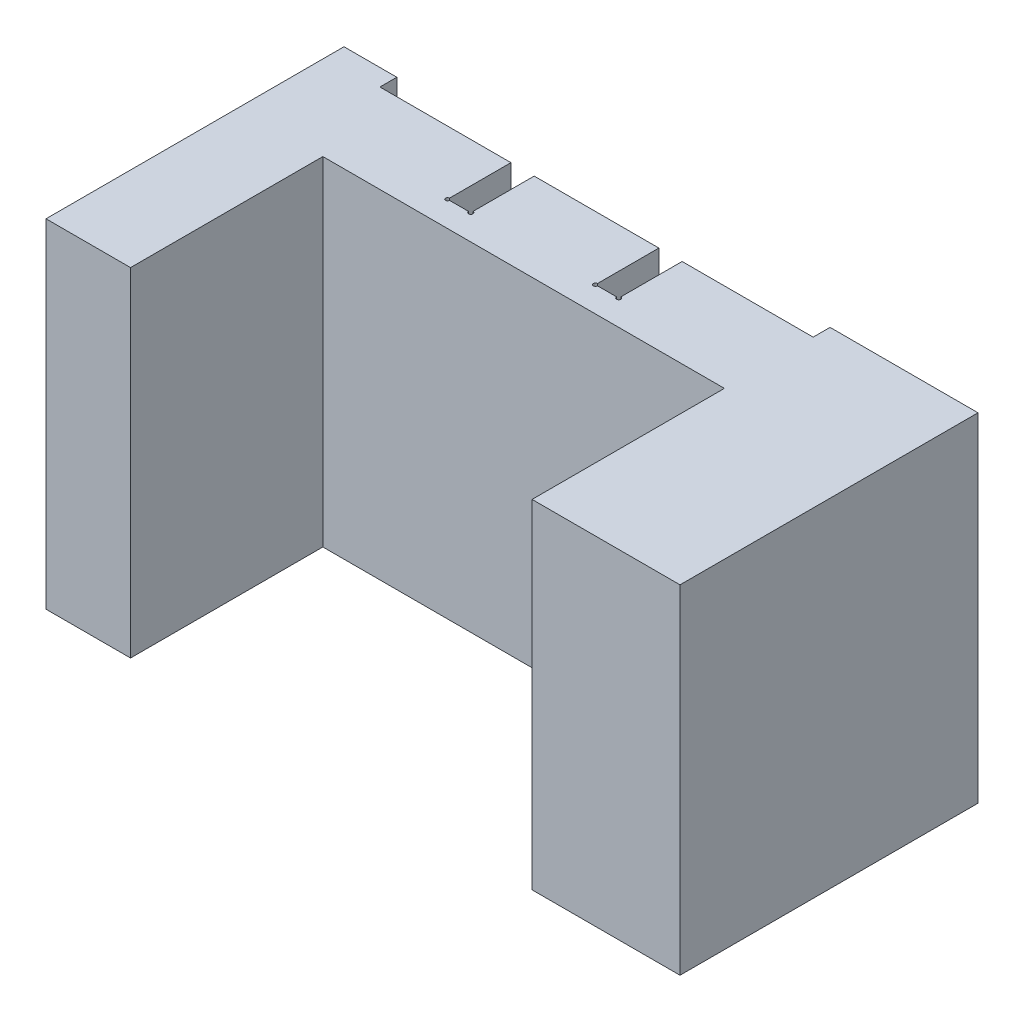
from build123d import *

# Parameters (mm, degrees)
SKETCH_1_W           = 30
SKETCH_1_H           = 28
EXTRUDE_1_DEPTH      = 10
CUT_EXTRUDE_2_DEPTH  = 0.8
M1_4X0_3_2_D         = 1.1
M1_4X0_3_2_DEPTH     = 3.7
M1_4X0_3_2_TIP       = 0.33047334
CUT_EXTRUDE_3_DEPTH  = 4
CUT_EXTRUDE_4_DEPTH  = 0.5
SKETCH_12_W          = 30
SKETCH_12_H          = 4.25
CUT_EXTRUDE_5_DEPTH  = 10
SKETCH_14_W          = 23
SKETCH_14_H          = 23.75
CUT_EXTRUDE_7_DEPTH  = 5
SKETCH_23_W          = 4
SKETCH_23_H          = 23.75
EXTRUDE_4_DEPTH      = 9.1
SKETCH_24_W          = 30
SKETCH_24_H          = 7.75
CUT_EXTRUDE_8_DEPTH  = 20
SKETCH_25_W          = 7
SKETCH_25_H          = 16
EXTRUDE_5_DEPTH      = 4.1
SKETCH_26_W          = 3
SKETCH_26_H          = 0.8
CUT_EXTRUDE_9_DEPTH  = 4.1
SKETCH_28_W          = 1.1
SKETCH_28_H          = 3
CUT_EXTRUDE_11_DEPTH = 4
CUT_EXTRUDE_START    = -4
SKETCH_29_R          = 0.1
CUT_EXTRUDE_12_DEPTH = 4


with BuildPart() as part:
    # 草图1 → 凸台-拉伸1 (new body)
    with BuildSketch(Plane.XY):
        with Locations((7.449728974, 2.736434109)):
            Rectangle(SKETCH_1_W, SKETCH_1_H)
    extrude(amount=EXTRUDE_1_DEPTH)

    # 草图2 → 切除-拉伸2 (cut)
    with BuildSketch(Plane(origin=(0, 0, 0), x_dir=(-1, 0, 0), z_dir=(0, 0, -1))):
        with BuildLine():
            Line((5.050271026, 16.736434109), (-15.449728974, 16.736434109))
            Line((-15.449728974, 16.736434109), (-15.449728974, 3.736434109))
            ThreePointArc((-15.449728974, 3.736434109), (-14.571049317, 1.615113765), (-12.449728974, 0.736434109))
            Line((-12.449728974, 0.736434109), (2.050271026, 0.736434109))
            ThreePointArc((2.050271026, 0.736434109), (4.17159137, 1.615113765), (5.050271026, 3.736434109))
            Line((5.050271026, 3.736434109), (5.050271026, 16.736434109))
        make_face()
    extrude(amount=-CUT_EXTRUDE_2_DEPTH, mode=Mode.SUBTRACT)

    # M1.4x0.3 螺纹孔2
    with Locations(Plane(origin=(0, 0, 0.8), x_dir=(-1, 0, 0), z_dir=(0, 0, -1))):
        with Locations((-12.199728974, 8.736434109), (1.800271026, 8.736434109)):
            Hole(M1_4X0_3_2_D / 2, depth=M1_4X0_3_2_DEPTH)
            with Locations((0, 0, -(M1_4X0_3_2_DEPTH + M1_4X0_3_2_TIP / 2))):  # 118° drill point
                Cone(0, M1_4X0_3_2_D / 2, M1_4X0_3_2_TIP, mode=Mode.SUBTRACT)

    # 草图10 → 切除-拉伸3 (cut)
    with BuildSketch(Plane(origin=(0, 16.736434109, 0), x_dir=(1, 0, 0), z_dir=(0, 1, 0))):
        with BuildLine():
            Line((9.249728974, -0.8), (8.149728974, -0.8))
            Line((8.149728974, -0.8), (8.149728974, -3.7))
            ThreePointArc((8.149728974, -3.7), (8.07901805, -3.870710433), (8.249728974, -3.800000693))
            Line((8.249728974, -3.800000693), (9.14947862, -3.800000693))
            ThreePointArc((9.14947862, -3.800000693), (9.320100726, -3.870799843), (9.249728974, -3.700001016))
            Line((9.249728974, -3.700001016), (9.249728974, -0.8))
        make_face()
        with BuildLine():
            Line((1.149728974, -0.8), (2.249728974, -0.8))
            Line((2.249728974, -0.8), (2.249728974, -3.696415438))
            ThreePointArc((2.249728974, -3.696415438), (2.32297432, -3.873245346), (2.146144411, -3.8))
            Line((2.146144411, -3.8), (1.245429293, -3.8))
            ThreePointArc((1.245429293, -3.8), (1.082058629, -3.867670345), (1.149728974, -3.704299681))
            Line((1.149728974, -3.704299681), (1.149728974, -0.8))
        make_face()
    extrude(amount=-CUT_EXTRUDE_3_DEPTH, mode=Mode.SUBTRACT)

    # 草图11 → 切除-拉伸4 (cut)
    with BuildSketch(Plane(origin=(0, 0, 0), x_dir=(-1, 0, 0), z_dir=(0, 0, -1))):
        with BuildLine():
            Line((-7.549728974, -2.063565891), (-2.849728974, -2.063565891))
            ThreePointArc((-2.849728974, -2.063565891), (-2.422952278, -2.240342587), (-2.599728974, -1.813565891))
            Line((-2.599728974, -1.813565891), (-2.599728974, 0.736434109))
            Line((-2.599728974, 0.736434109), (-7.799728974, 0.736434109))
            Line((-7.799728974, 0.736434109), (-7.799728974, -1.813565891))
            ThreePointArc((-7.799728974, -1.813565891), (-7.976505669, -2.240342587), (-7.549728974, -2.063565891))
        make_face()
    extrude(amount=-CUT_EXTRUDE_4_DEPTH, mode=Mode.SUBTRACT)

    # 草图12 → 切除-拉伸5 (cut)
    with BuildSketch(Plane(origin=(0, 0, 0), x_dir=(-1, 0, 0), z_dir=(0, 0, -1))):
        with Locations((-7.449728974, -9.138565891)):
            Rectangle(SKETCH_12_W, SKETCH_12_H)
    extrude(amount=-CUT_EXTRUDE_5_DEPTH, mode=Mode.SUBTRACT)

    # 草图14 → 切除-拉伸7 (cut)
    with BuildSketch(Plane.XY.offset(10)):
        with Locations((3.949728974, 4.861434109)):
            Rectangle(SKETCH_14_W, SKETCH_14_H)
    extrude(amount=-CUT_EXTRUDE_7_DEPTH, mode=Mode.SUBTRACT)

    # 草图23 → 凸台-拉伸4 (add)
    with BuildSketch(Plane.XY.offset(5)):
        with Locations((-5.550271026, 4.861434109)):
            Rectangle(SKETCH_23_W, SKETCH_23_H)
    extrude(amount=EXTRUDE_4_DEPTH)

    # 草图24 → 切除-拉伸8 (cut)
    with BuildSketch(Plane(origin=(0, 0, 0), x_dir=(-1, 0, 0), z_dir=(0, 0, -1))):
        with Locations((-7.449728974, -3.138565891)):
            Rectangle(SKETCH_24_W, SKETCH_24_H)
    extrude(amount=-CUT_EXTRUDE_8_DEPTH, mode=Mode.SUBTRACT)

    # 草图25 → 凸台-拉伸5 (add)
    with BuildSketch(Plane.XY.offset(10)):
        with Locations((18.949728974, 8.736434109)):
            Rectangle(SKETCH_25_W, SKETCH_25_H)
    extrude(amount=EXTRUDE_5_DEPTH)

    # 草图26 → 切除-拉伸9 (cut)
    with BuildSketch(Plane.XZ.offset(-0.736434109)):
        with Locations((13.949728974, 0.4)):
            Rectangle(SKETCH_26_W, SKETCH_26_H)
        with Locations((-3.550271026, 0.4)):
            Rectangle(SKETCH_26_W, SKETCH_26_H)
    extrude(amount=-CUT_EXTRUDE_9_DEPTH, mode=Mode.SUBTRACT)

    # 草图28 → 切除-拉伸11 (cut)
    with BuildSketch(Plane.XZ.offset(-0.736434109)):
        with Locations((8.699728974, 2.3)):
            Rectangle(SKETCH_28_W, SKETCH_28_H)
        with Locations((1.699728974, 2.3)):
            Rectangle(SKETCH_28_W, SKETCH_28_H)
    extrude(amount=-CUT_EXTRUDE_11_DEPTH, mode=Mode.SUBTRACT)

    # 草图29 → 切除-拉伸12 (cut)
    with BuildSketch(Plane.XZ.offset(-0.736434109).offset(CUT_EXTRUDE_START)):
        with Locations((9.249728974, 3.8)):
            Circle(SKETCH_29_R)
        with Locations((8.149728974, 3.8)):
            Circle(SKETCH_29_R)
        with Locations((2.249728974, 3.8)):
            Circle(SKETCH_29_R)
        with Locations((1.149728974, 3.8)):
            Circle(SKETCH_29_R)
    extrude(amount=CUT_EXTRUDE_12_DEPTH, mode=Mode.SUBTRACT)


solid = part.part
